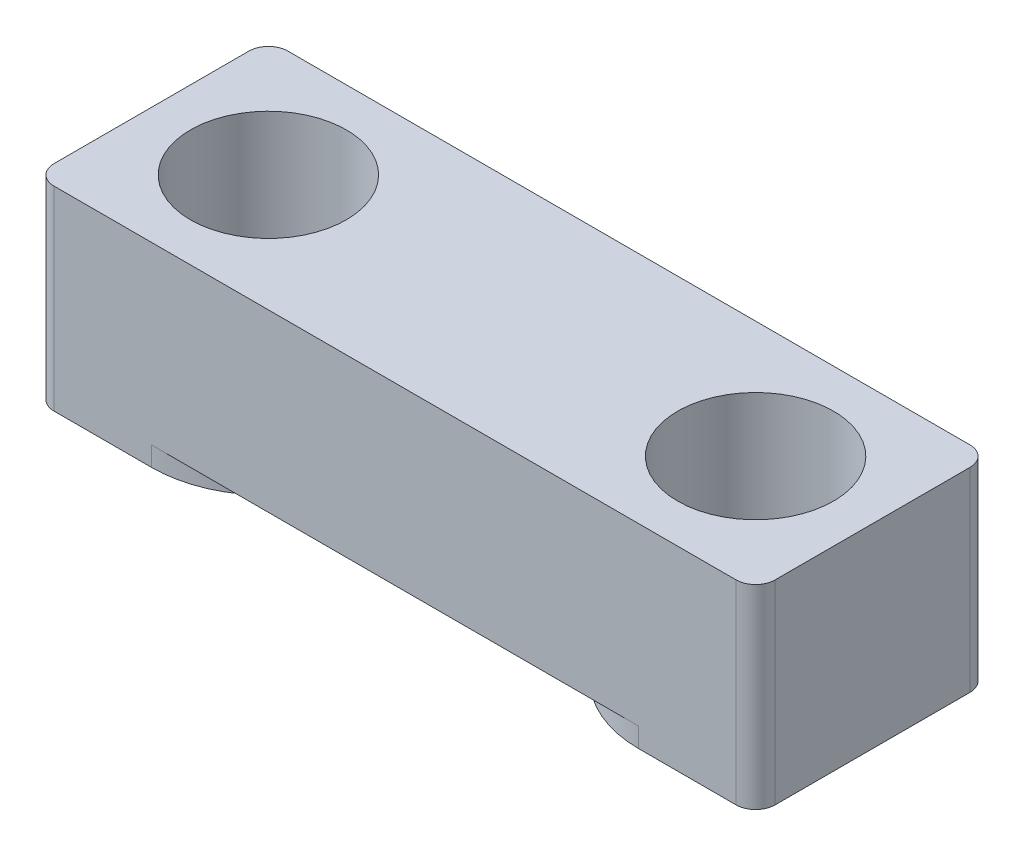
from build123d import *

# Parameters (mm, degrees)
SKETCH1_W           = 14.8
SKETCH1_H           = 4.8
SKETCH1_R           = 1.6
BOSS_EXTRUDE1_DEPTH = 4
CUT_EXTRUDE2_DEPTH  = 0.4
SKETCH3_R           = 1.6
SKETCH3_R_2         = 1.1
BOSS_EXTRUDE2_DEPTH = 1
FILLET1_R           = 0.4


with BuildPart() as part:
    # Sketch1 → Boss-Extrude1 (new body)
    with BuildSketch(Plane(origin=(0, 0, 0), x_dir=(1, 0, 0), z_dir=(0, 1, 0))):
        Rectangle(SKETCH1_W, SKETCH1_H)
        with Locations(Location((-5, 0, 0), (0, 0, 270))):
            Circle(SKETCH1_R, mode=Mode.SUBTRACT)
        with Locations(Location((5, 0, 0), (0, 0, 270))):
            Circle(SKETCH1_R, mode=Mode.SUBTRACT)
    extrude(amount=BOSS_EXTRUDE1_DEPTH)

    # Sketch2 → Cut-Extrude2 (cut)
    with BuildSketch(Plane.XZ):
        with BuildLine():
            Line((-5, -2.4), (5, -2.4))
            ThreePointArc((5, -2.4), (2.6, 0), (5, 2.4))
            Line((5, 2.4), (-5, 2.4))
            ThreePointArc((-5, 2.4), (-2.6, 0), (-5, -2.4))
        make_face()
    extrude(amount=-CUT_EXTRUDE2_DEPTH, mode=Mode.SUBTRACT)

    # Sketch3 → Boss-Extrude2 (add)
    # profile 1 of 2: a face of its own
    with BuildSketch(Plane.XZ):
        with Locations(Location((5, 0, 0), (0, 0, 90))):
            Circle(SKETCH3_R)
        with Locations(Location((5, 0, 0), (0, 0, 270))):
            Circle(SKETCH3_R_2, mode=Mode.SUBTRACT)
    # profile 2 of 2: a face of its own
    with BuildSketch(Plane.XZ):
        with Locations(Location((-5, 0, 0), (0, 0, 90))):
            Circle(SKETCH3_R)
        with Locations(Location((-5, 0, 0), (0, 0, 270))):
            Circle(SKETCH3_R_2, mode=Mode.SUBTRACT)
    extrude(amount=-BOSS_EXTRUDE2_DEPTH)

    # Fillet1
    fillet1_edges = [part.edges().sort_by_distance(p)[0] for p in [
        (-7.4, 2, -2.4),
        (7.4, 2, -2.4),
        (7.4, 2, 2.4),
        (-7.4, 2, 2.4),
    ]]
    fillet(fillet1_edges, radius=FILLET1_R)


solid = part.part
